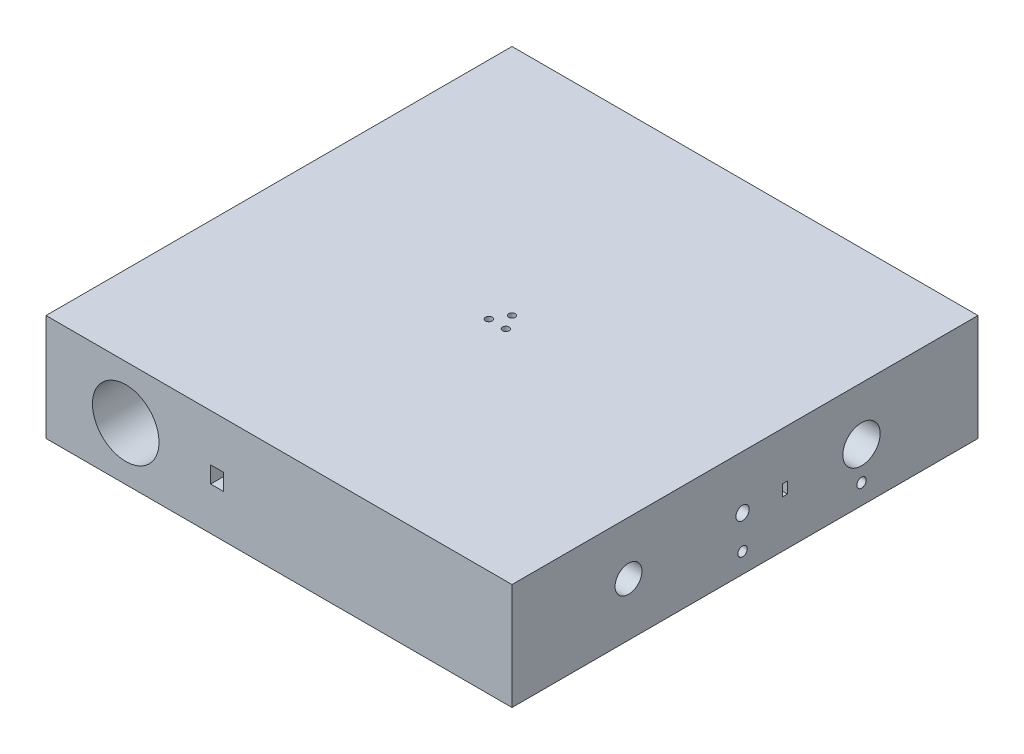
from build123d import *

# Parameters (mm, degrees)
SKETCH1_W               = 350
SKETCH1_H               = 350
BOSS_EXTRUDE1_DEPTH     = 80
CUT_EXTRUDE1_DEPTH      = 261.096136073
SKETCH2_4_R             = 2.5
CUT_EXTRUDE2_DEPTH      = 261.096136073
SKETCH2_5_R             = 2.5
CUT_EXTRUDE3_DEPTH      = 261.096136073
SKETCH3_W               = 3.7
SKETCH3_H               = 8.5
CUT_EXTRUDE4_DEPTH      = 400.405808671
SKETCH4_R               = 10.1
CUT_EXTRUDE5_DEPTH      = 400.405808671
CUT_EXTRUDE7_DEPTH      = 10
CUT_EXTRUDE7_DEPTH_BACK = 400.405808671
SKETCH6_R               = 3.555
SKETCH7_R               = 3.555
CUT_EXTRUDE8_DEPTH      = 400.405808778
SKETCH9_R               = 14
CUT_EXTRUDE10_DEPTH     = 400.405808778
SKETCH11_R              = 5.025
CUT_EXTRUDE12_DEPTH     = 400.405808778
SKETCH13_R              = 25
CUT_EXTRUDE14_DEPTH     = 400.405808735
SKETCH14_W              = 9.7
SKETCH14_H              = 12.5
CUT_EXTRUDE18_DEPTH     = 400.405808822


with BuildPart() as part:
    # Sketch1 → Boss-Extrude1 (new body)
    with BuildSketch(Plane(origin=(0, 0, 0), x_dir=(1, 0, 0), z_dir=(0, 1, 0))):
        Rectangle(SKETCH1_W, SKETCH1_H)
    extrude(amount=BOSS_EXTRUDE1_DEPTH)

    # Sketch2 → Cut-Extrude1 (cut, through all)
    with BuildSketch(Plane(origin=(0, 80, 0), x_dir=(1, 0, 0), z_dir=(0, 1, 0))):
        with BuildLine():
            ThreePointArc((0, 2.5), (-1.767766953, -1.767766953), (2.5, 0))
            ThreePointArc((2.5, 0), (1.767766953, 1.767766953), (0, 2.5))
        make_face()
    extrude(amount=-CUT_EXTRUDE1_DEPTH, mode=Mode.SUBTRACT)

    # Sketch2<4> → Cut-Extrude2 (cut, through all)
    with BuildSketch(Plane(origin=(0, 80, 0), x_dir=(1, 0, 0), z_dir=(0, 1, 0))):
        with Locations((6.4, -11.027352357)):
            Circle(SKETCH2_4_R)
    extrude(amount=-CUT_EXTRUDE2_DEPTH, mode=Mode.SUBTRACT)

    # Sketch2<5> → Cut-Extrude3 (cut, through all)
    with BuildSketch(Plane(origin=(0, 80, 0), x_dir=(1, 0, 0), z_dir=(0, 1, 0))):
        with Locations((-6.4, -11.027352357)):
            Circle(SKETCH2_5_R)
    extrude(amount=-CUT_EXTRUDE3_DEPTH, mode=Mode.SUBTRACT)

    # Sketch3 → Cut-Extrude4 (cut, through all)
    with BuildSketch(Plane.ZY.offset(175)):
        with Locations((-30, 39.681610839)):
            Rectangle(SKETCH3_W, SKETCH3_H)
    extrude(amount=-CUT_EXTRUDE4_DEPTH, mode=Mode.SUBTRACT)

    # Sketch4 → Cut-Extrude5 (cut, through all)
    with BuildSketch(Plane.ZY.offset(175)):
        with Locations((87.5, 40)):
            Circle(SKETCH4_R)
    extrude(amount=-CUT_EXTRUDE5_DEPTH, mode=Mode.SUBTRACT)

    # Sketch6 → Cut-Extrude7 (cut, two sides: drawn at the far end of the back side and taken through both)
    with BuildSketch(Plane.ZY.offset(175).offset(-CUT_EXTRUDE7_DEPTH_BACK)):
        with Locations((1.85, 15)):
            Circle(SKETCH6_R)
    extrude(amount=CUT_EXTRUDE7_DEPTH + CUT_EXTRUDE7_DEPTH_BACK, mode=Mode.SUBTRACT)

    # Sketch7 → Cut-Extrude8 (cut, through all)
    with BuildSketch(Plane.ZY.offset(175)):
        with Locations((-87.5, 15)):
            Circle(SKETCH7_R)
    extrude(amount=-CUT_EXTRUDE8_DEPTH, mode=Mode.SUBTRACT)

    # Sketch9 → Cut-Extrude10 (cut, through all)
    with BuildSketch(Plane.ZY.offset(175)):
        with Locations((-87.5, 40)):
            Circle(SKETCH9_R)
    extrude(amount=-CUT_EXTRUDE10_DEPTH, mode=Mode.SUBTRACT)

    # Sketch11 → Cut-Extrude12 (cut, through all)
    with BuildSketch(Plane.ZY.offset(175)):
        with Locations((1.85, 40)):
            Circle(SKETCH11_R)
    extrude(amount=-CUT_EXTRUDE12_DEPTH, mode=Mode.SUBTRACT)

    # Sketch13 → Cut-Extrude14 (cut, through all)
    with BuildSketch(Plane(origin=(0, 0, -175), x_dir=(-1, 0, 0), z_dir=(0, 0, -1))):
        with Locations((115.112005789, 40)):
            Circle(SKETCH13_R)
    extrude(amount=-CUT_EXTRUDE14_DEPTH, mode=Mode.SUBTRACT)

    # Sketch14 → Cut-Extrude18 (cut, through all)
    with BuildSketch(Plane(origin=(0, 0, -175), x_dir=(-1, 0, 0), z_dir=(0, 0, -1))):
        with Locations((46.47975887, 38.444138081)):
            Rectangle(SKETCH14_W, SKETCH14_H)
    extrude(amount=-CUT_EXTRUDE18_DEPTH, mode=Mode.SUBTRACT)


solid = part.part
